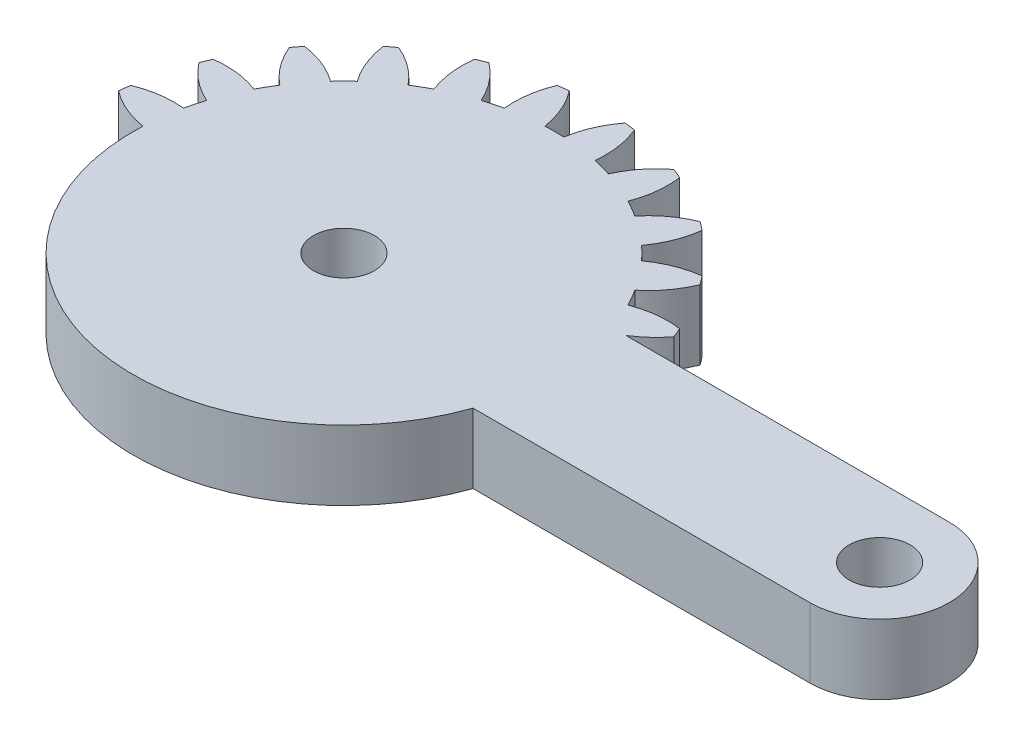
from build123d import *

# Parameters (mm, degrees)
SKETCH1_R           = 1.75
BOSS_EXTRUDE1_DEPTH = 4


with BuildPart() as part:
    # Sketch1 → Boss-Extrude1 (new body)
    with BuildSketch(Plane(origin=(0, 4, 0), x_dir=(1, 0, 0), z_dir=(0, 1, 0))):
        with BuildLine():
            Line((1.305695063, -4), (20.643657446, -4))
            ThreePointArc((20.643657446, -4), (24.643657446, 0), (20.643657446, 4))
            Line((20.643657446, 4), (2.081641936, 4))
            ThreePointArc((2.081641936, 4), (2.861028333, 4.588201733), (3.521749436, 5.30713988))
            ThreePointArc((3.521749436, 5.30713988), (3.405395609, 5.596745198), (3.282888305, 5.883801663))
            ThreePointArc((3.282888305, 5.883801663), (1.93527598, 5.894040025), (0.627094961, 5.57027124))
            ThreePointArc((0.627094961, 5.57027124), (0.366286148, 6.046375), (0.084372603, 6.510293938))
            ThreePointArc((0.084372603, 6.510293938), (1.018855105, 7.48132754), (1.683794586, 8.65351323))
            ThreePointArc((1.683794586, 8.65351323), (1.496450048, 8.903135899), (1.303821399, 9.148703928))
            ThreePointArc((1.303821399, 9.148703928), (-0.000522033, 8.809805691), (-1.180330337, 8.158486898))
            ThreePointArc((-1.180330337, 8.158486898), (-1.555477026, 8.550865528), (-1.947855656, 8.926012217))
            ThreePointArc((-1.947855656, 8.926012217), (-1.296536862, 10.105820521), (-0.957638625, 11.410163953))
            ThreePointArc((-0.957638625, 11.410163953), (-1.203206655, 11.602792602), (-1.452829324, 11.79013714))
            ThreePointArc((-1.452829324, 11.79013714), (-2.625015014, 11.125197659), (-3.596048616, 10.190715157))
            ThreePointArc((-3.596048616, 10.190715157), (-4.059967554, 10.472628702), (-4.536071314, 10.733437515))
            ThreePointArc((-4.536071314, 10.733437515), (-4.212302529, 12.041618533), (-4.222540891, 13.389230859))
            ThreePointArc((-4.222540891, 13.389230859), (-4.509597355, 13.511738163), (-4.799202674, 13.62809199))
            ThreePointArc((-4.799202674, 13.62809199), (-5.759348103, 12.682425791), (-6.455432668, 11.528463019))
            ThreePointArc((-6.455432668, 11.528463019), (-6.976508546, 11.680699536), (-7.503891752, 11.809396783))
            ThreePointArc((-7.503891752, 11.809396783), (-7.529737283, 13.156800143), (-7.888414517, 14.455843809))
            ThreePointArc((-7.888414517, 14.455843809), (-8.197396993, 14.499881098), (-8.507248835, 14.537314892))
            ThreePointArc((-8.507248835, 14.537314892), (-9.18992168, 13.375367565), (-9.563620196, 12.080565177))
            ThreePointArc((-9.563620196, 12.080565177), (-10.106342554, 12.09275), (-10.649064912, 12.080565177))
            ThreePointArc((-10.649064912, 12.080565177), (-11.022763428, 13.375367565), (-11.705436272, 14.537314892))
            ThreePointArc((-11.705436272, 14.537314892), (-12.015288115, 14.499881098), (-12.324270591, 14.455843809))
            ThreePointArc((-12.324270591, 14.455843809), (-12.682947825, 13.156800143), (-12.708793355, 11.809396783))
            ThreePointArc((-12.708793355, 11.809396783), (-13.236176561, 11.680699536), (-13.757252439, 11.528463019))
            ThreePointArc((-13.757252439, 11.528463019), (-14.453337005, 12.682425791), (-15.413482434, 13.62809199))
            ThreePointArc((-15.413482434, 13.62809199), (-15.703087752, 13.511738163), (-15.990144217, 13.389230859))
            ThreePointArc((-15.990144217, 13.389230859), (-16.000382579, 12.041618533), (-15.676613793, 10.733437515))
            ThreePointArc((-15.676613793, 10.733437515), (-16.152717554, 10.472628702), (-16.616636492, 10.190715157))
            ThreePointArc((-16.616636492, 10.190715157), (-17.587670094, 11.125197659), (-18.759855783, 11.79013714))
            ThreePointArc((-18.759855783, 11.79013714), (-19.009478453, 11.602792602), (-19.255046482, 11.410163953))
            ThreePointArc((-19.255046482, 11.410163953), (-18.916148245, 10.105820521), (-18.264829452, 8.926012217))
            ThreePointArc((-18.264829452, 8.926012217), (-18.657208082, 8.550865528), (-19.032354771, 8.158486898))
            ThreePointArc((-19.032354771, 8.158486898), (-20.212163074, 8.809805691), (-21.516506507, 9.148703928))
            ThreePointArc((-21.516506507, 9.148703928), (-21.709135156, 8.903135899), (-21.896479694, 8.65351323))
            ThreePointArc((-21.896479694, 8.65351323), (-21.231540213, 7.48132754), (-20.297057711, 6.510293938))
            ThreePointArc((-20.297057711, 6.510293938), (-20.578971255, 6.046375), (-20.839780068, 5.57027124))
            ThreePointArc((-20.839780068, 5.57027124), (-22.147961087, 5.894040025), (-23.495573413, 5.883801663))
            ThreePointArc((-23.495573413, 5.883801663), (-23.618080717, 5.596745198), (-23.734434544, 5.30713988))
            ThreePointArc((-23.734434544, 5.30713988), (-22.788768345, 4.346994451), (-21.634805572, 3.650909885))
            ThreePointArc((-21.634805572, 3.650909885), (-21.78704209, 3.129834008), (-21.915739337, 2.602450802))
            ThreePointArc((-21.915739337, 2.602450802), (-23.263142697, 2.576605271), (-24.562186363, 2.217928037))
            ThreePointArc((-24.562186363, 2.217928037), (-24.606223651, 1.908945561), (-24.643657446, 1.599093719))
            ThreePointArc((-24.643657446, 1.599093719), (-23.481710119, 0.916420874), (-22.186907731, 0.542722358))
            ThreePointArc((-22.186907731, 0.542722358), (-12.402167869, -11.872817218), (1.305695063, -4))
        make_face()
        with Locations(Location((20.643657446, 0, 0), (0, 0, 90))):
            Circle(SKETCH1_R, mode=Mode.SUBTRACT)
        with Locations(Location((-10.106342554, 0, 0), (0, 0, 90))):
            Circle(SKETCH1_R, mode=Mode.SUBTRACT)
    extrude(amount=-BOSS_EXTRUDE1_DEPTH)


solid = part.part
